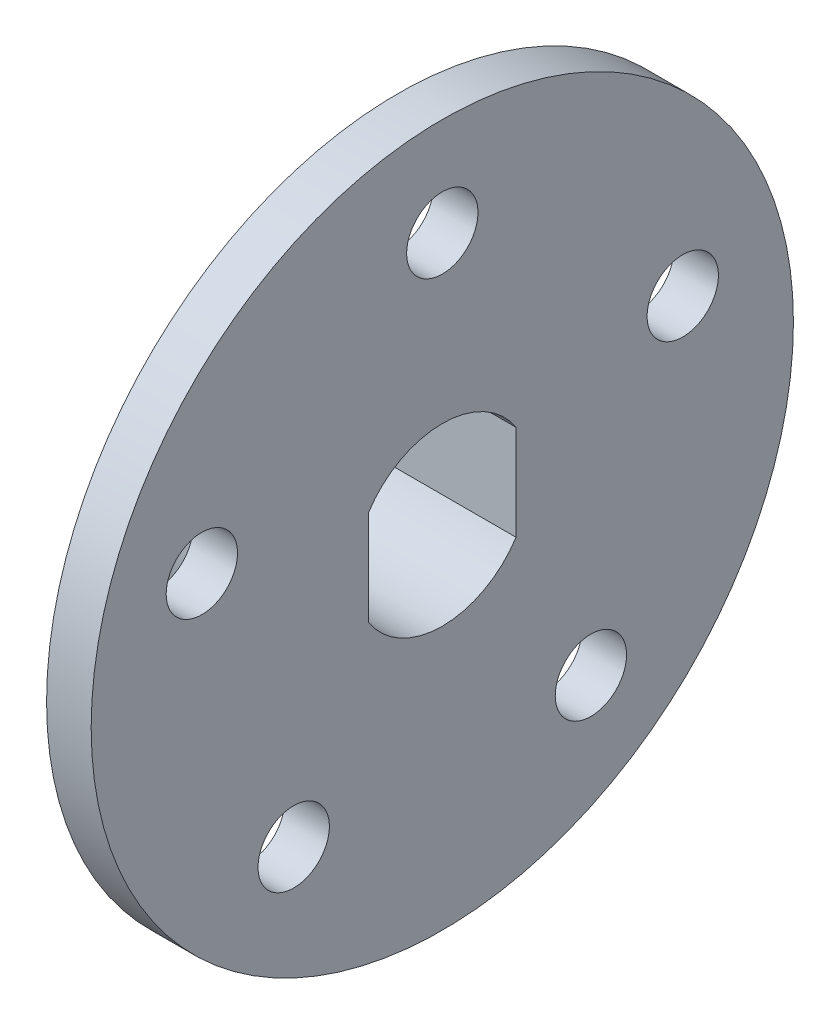
from build123d import *

# Parameters (mm, degrees)
SKETCH1_R           = 11
BOSS_EXTRUDE1_DEPTH = 5.925
SKETCH2_R           = 25
BOSS_EXTRUDE2_DEPTH = 3.175
SKETCH3_R           = 2.54
CUT_EXTRUDE1_DEPTH  = 36.848369907


with BuildPart() as part:
    # Sketch1 → Boss-Extrude1 (new body)
    with BuildSketch(Plane(origin=(0, 0, 0), x_dir=(0, 0, -1), z_dir=(1, 0, 0))):
        Circle(SKETCH1_R)
        with BuildLine():
            Line((-5.25, 3.391164992), (-5.25, -3.391164992))
            ThreePointArc((-5.25, -3.391164992), (0, -6.25), (5.25, -3.391164992))
            Line((5.25, -3.391164992), (5.25, 3.391164992))
            ThreePointArc((5.25, 3.391164992), (0, 6.25), (-5.25, 3.391164992))
        make_face(mode=Mode.SUBTRACT)
    extrude(amount=BOSS_EXTRUDE1_DEPTH)

    # Sketch2 → Boss-Extrude2 (add)
    with BuildSketch(Plane(origin=(5.925, 0, 0), x_dir=(0, 0, -1), z_dir=(1, 0, 0))):
        Circle(SKETCH2_R)
        with BuildLine():
            Line((-5.25, 3.391164992), (-5.25, -3.391164992))
            ThreePointArc((-5.25, -3.391164992), (0, -6.25), (5.25, -3.391164992))
            Line((5.25, -3.391164992), (5.25, 3.391164992))
            ThreePointArc((5.25, 3.391164992), (0, 6.25), (-5.25, 3.391164992))
        make_face(mode=Mode.SUBTRACT)
    extrude(amount=BOSS_EXTRUDE2_DEPTH)

    # Sketch3 → Cut-Extrude1 (cut, through all)
    with BuildSketch(Plane.ZY.offset(-5.925)):
        with Locations((0, 18)):
            Circle(SKETCH3_R)
        with Locations((17.119017293, 5.562305899)):
            Circle(SKETCH3_R)
        with Locations((10.580134541, -14.562305899)):
            Circle(SKETCH3_R)
        with Locations((-10.580134541, -14.562305899)):
            Circle(SKETCH3_R)
        with Locations((-17.119017293, 5.562305899)):
            Circle(SKETCH3_R)
    extrude(amount=-CUT_EXTRUDE1_DEPTH, mode=Mode.SUBTRACT)


solid = part.part
